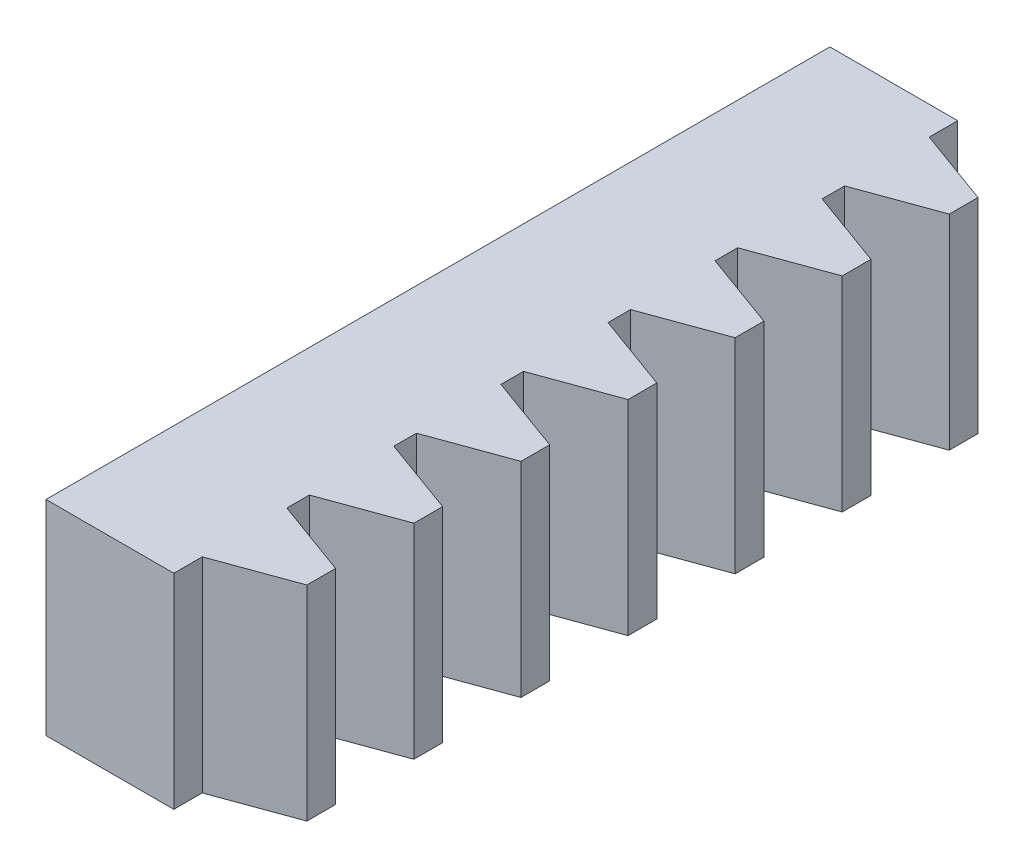
from build123d import *

# Parameters (mm, degrees)
SKETCH10_W                = 6
SKETCH10_H                = 6
RACK_BAR_DEPTH            = 11.5
RACK_ROOT_STEP_DEPTH      = 13.257650672
RACK_ROOT_STEP_DEPTH_BACK = 13.257650672
SKETCH12_W                = 2.75
SKETCH12_H                = 24
RACK_TEETH_DEPTH          = 3
SKETCH15_R                = 1.001320398
CUT_EXTRUDE2_DEPTH        = 4.5


with BuildPart() as part:
    # Sketch10 → RACK_BAR (new, symmetric)
    with BuildSketch(Plane.XY):
        Rectangle(SKETCH10_W, SKETCH10_H)
    extrude(amount=RACK_BAR_DEPTH, both=True)

    # Sketch12 → RACK_ROOT_STEP (cut, two sides: drawn at the far end of the back side and taken through both)
    with BuildSketch(Plane(origin=(0, 0, 0), x_dir=(1, 0, 0), z_dir=(0, 1, 0)).offset(-RACK_ROOT_STEP_DEPTH_BACK)):
        with Locations((2.125, 0)):
            Rectangle(SKETCH12_W, SKETCH12_H)
    extrude(amount=RACK_ROOT_STEP_DEPTH + RACK_ROOT_STEP_DEPTH_BACK, mode=Mode.SUBTRACT)

    # Sketch13 → RACK_TEETH (add, symmetric)
    with BuildSketch(Plane(origin=(0, 0, 0), x_dir=(1, 0, 0), z_dir=(0, 1, 0))):
        Polygon((0.5, 1.3314), (3, 0.4214), (3, -0.4214), (0.5, -1.3314), align=None)
        Polygon((0.5, 4.473), (3, 3.563), (3, 2.7202), (0.5, 1.8102), align=None)
        Polygon((0.5, -1.8102), (3, -2.7202), (3, -3.563), (0.5, -4.473), align=None)
        Polygon((0.5, 7.6146), (3, 6.7046), (3, 5.8618), (0.5, 4.9518), align=None)
        Polygon((0.5, -4.9518), (3, -5.8618), (3, -6.7046), (0.5, -7.6146), align=None)
        Polygon((0.5, 10.7562), (3, 9.8462), (3, 9.0034), (0.5, 8.0934), align=None)
        Polygon((0.5, -8.0934), (3, -9.0034), (3, -9.8462), (0.5, -10.7562), align=None)
    extrude(amount=RACK_TEETH_DEPTH, both=True)

    # Sketch15 → Cut-Extrude2 (cut)
    with BuildSketch(Plane(origin=(0, 0, -11.5), x_dir=(-1, 0, 0), z_dir=(0, 0, -1))):
        with Locations((1.25, 0)):
            Circle(SKETCH15_R)
    extrude(amount=-CUT_EXTRUDE2_DEPTH, mode=Mode.SUBTRACT)


solid = part.part
